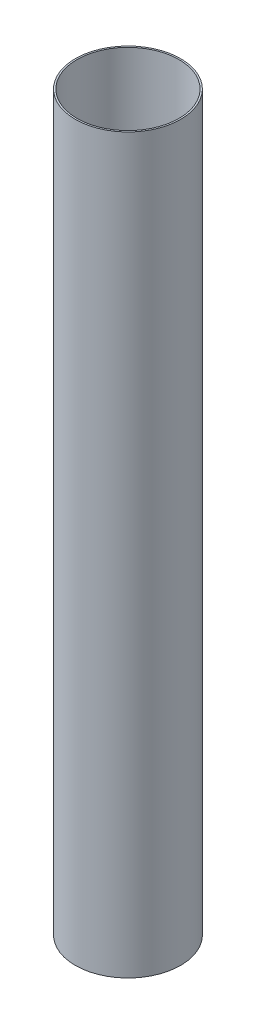
from build123d import *

# Parameters (mm, degrees)
MOTOR_MOUNT_PROFILE_SKETCH_R   = 51.1048
MOTOR_MOUNT_PROFILE_SKETCH_R_2 = 49.53
MOTOR_MOUNT_BODY_DEPTH         = 711.2


with BuildPart() as part:
    # Motor Mount Profile Sketch → Motor Mount Body (new body)
    with BuildSketch(Plane(origin=(0, 0, 0), x_dir=(1, 0, 0), z_dir=(0, 1, 0))):
        with Locations(Location((0, 0, 0), (0, 0, 270))):
            Circle(MOTOR_MOUNT_PROFILE_SKETCH_R)
        with Locations(Location((0, 0, 0), (0, 0, 270))):
            Circle(MOTOR_MOUNT_PROFILE_SKETCH_R_2, mode=Mode.SUBTRACT)
    extrude(amount=MOTOR_MOUNT_BODY_DEPTH)


solid = part.part
